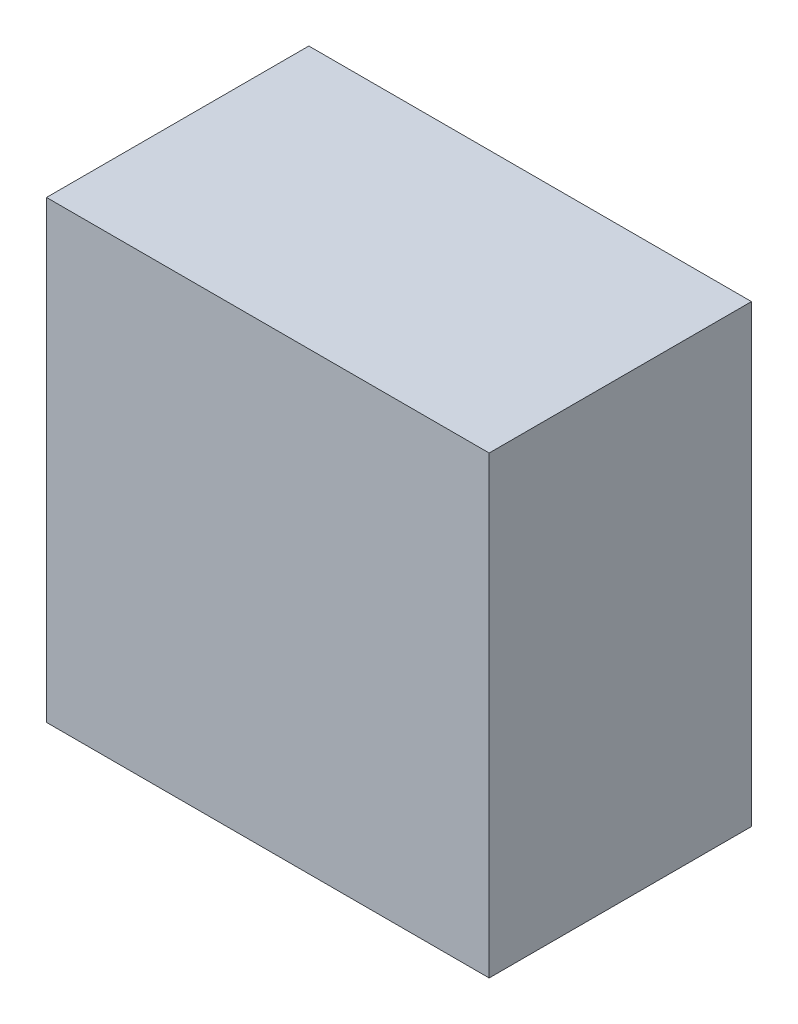
from build123d import *

# Parameters (mm, degrees)
SKETCH1_W           = 25.313059946
SKETCH1_H           = 26
BOSS_EXTRUDE1_DEPTH = 15


with BuildPart() as part:
    # Sketch1 → Boss-Extrude1 (new body)
    with BuildSketch(Plane.XY):
        with Locations((0, 13)):
            Rectangle(SKETCH1_W, SKETCH1_H)
    extrude(amount=BOSS_EXTRUDE1_DEPTH)


solid = part.part
